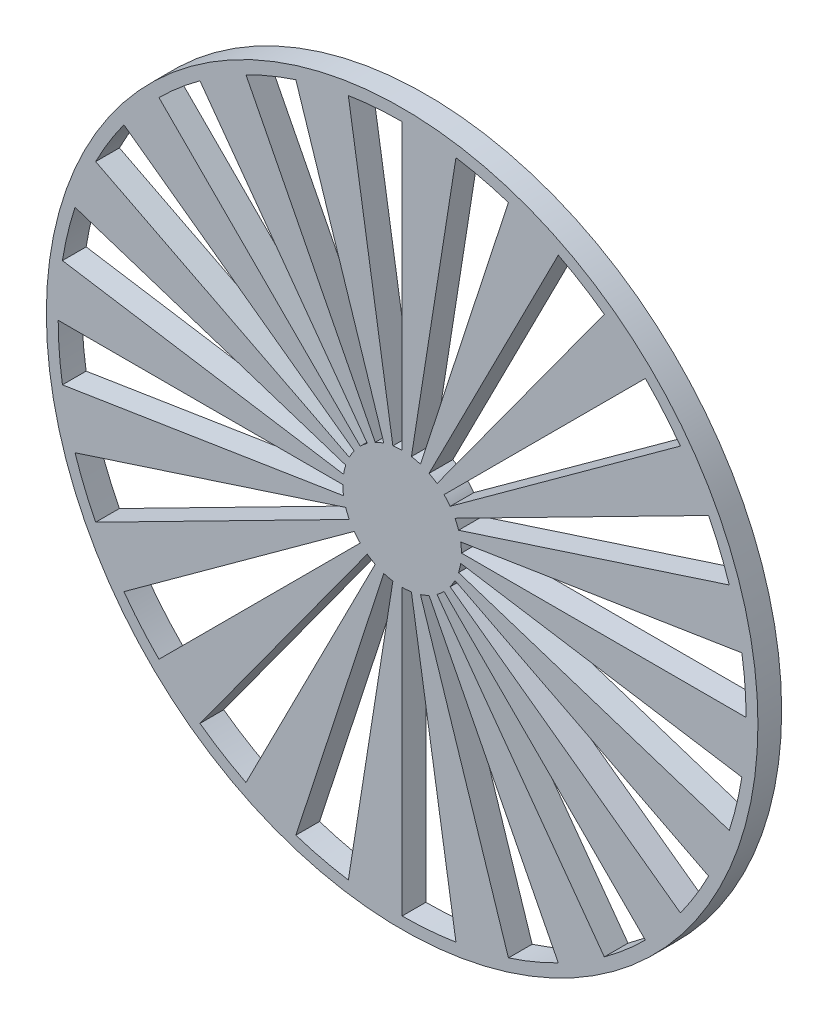
from build123d import *

# Parameters (mm, degrees)
SKETCH1_R           = 38.1
BOSS_EXTRUDE3_DEPTH = 2.54


with BuildPart() as part:
    # Sketch1 → Boss-Extrude3 (new body)
    with BuildSketch(Plane.XY):
        Circle(SKETCH1_R)
        with BuildLine():
            Line((0, -36.83), (0, -6.35))
            ThreePointArc((0, -6.35), (0.498215258, -6.330425069), (0.993358853, -6.271820963))
            Line((0.993358853, -6.271820963), (5.761481347, -36.376561584))
            ThreePointArc((5.761481347, -36.376561584), (2.889648496, -36.716465401), (0, -36.83))
        make_face(mode=Mode.SUBTRACT)
        with BuildLine():
            Line((-0.993358853, -6.271820963), (-5.761481347, -36.376561584))
            ThreePointArc((-5.761481347, -36.376561584), (-8.597792751, -35.812384168), (-11.381095903, -35.027411495))
            Line((-11.381095903, -35.027411495), (-1.962257914, -6.039208878))
            ThreePointArc((-1.962257914, -6.039208878), (-1.48237806, -6.174548995), (-0.993358853, -6.271820963))
        make_face(mode=Mode.SUBTRACT)
        with BuildLine():
            ThreePointArc((16.720470105, -32.815770286), (14.094230814, -34.026483182), (11.381095903, -35.027411495))
            Line((11.381095903, -35.027411495), (1.962257914, -6.039208878))
            ThreePointArc((1.962257914, -6.039208878), (2.430039796, -5.866635031), (2.882839673, -5.657891429))
            Line((2.882839673, -5.657891429), (16.720470105, -32.815770286))
        make_face(mode=Mode.SUBTRACT)
        with BuildLine():
            ThreePointArc((26.042742751, -26.042742751), (23.91917162, -28.005751713), (21.648130842, -29.796095903))
            Line((21.648130842, -29.796095903), (3.732436352, -5.137257914))
            ThreePointArc((3.732436352, -5.137257914), (4.123995107, -4.828577882), (4.490128061, -4.490128061))
            Line((4.490128061, -4.490128061), (26.042742751, -26.042742751))
        make_face(mode=Mode.SUBTRACT)
        with BuildLine():
            ThreePointArc((32.815770286, -16.720470105), (31.402737253, -19.243622138), (29.796095903, -21.648130842))
            Line((29.796095903, -21.648130842), (5.137257914, -3.732436352))
            ThreePointArc((5.137257914, -3.732436352), (5.414265044, -3.317865886), (5.657891429, -2.882839673))
            Line((5.657891429, -2.882839673), (32.815770286, -16.720470105))
        make_face(mode=Mode.SUBTRACT)
        with BuildLine():
            ThreePointArc((36.376561584, -5.761481347), (35.812384168, -8.597792751), (35.027411495, -11.381095903))
            Line((35.027411495, -11.381095903), (6.039208878, -1.962257914))
            ThreePointArc((6.039208878, -1.962257914), (6.174548995, -1.48237806), (6.271820963, -0.993358853))
            Line((6.271820963, -0.993358853), (36.376561584, -5.761481347))
        make_face(mode=Mode.SUBTRACT)
        with BuildLine():
            ThreePointArc((36.376561584, 5.761481347), (36.716465401, 2.889648496), (36.83, 0))
            Line((36.83, 0), (6.35, 0))
            ThreePointArc((6.35, 0), (6.330425069, 0.498215258), (6.271820963, 0.993358853))
            Line((6.271820963, 0.993358853), (36.376561584, 5.761481347))
        make_face(mode=Mode.SUBTRACT)
        with BuildLine():
            ThreePointArc((32.815770286, 16.720470105), (34.026483182, 14.094230814), (35.027411495, 11.381095903))
            Line((35.027411495, 11.381095903), (6.039208878, 1.962257914))
            ThreePointArc((6.039208878, 1.962257914), (5.866635031, 2.430039796), (5.657891429, 2.882839673))
            Line((5.657891429, 2.882839673), (32.815770286, 16.720470105))
        make_face(mode=Mode.SUBTRACT)
        with BuildLine():
            ThreePointArc((26.042742751, 26.042742751), (28.005751713, 23.91917162), (29.796095903, 21.648130842))
            Line((29.796095903, 21.648130842), (5.137257914, 3.732436352))
            ThreePointArc((5.137257914, 3.732436352), (4.828577882, 4.123995107), (4.490128061, 4.490128061))
            Line((4.490128061, 4.490128061), (26.042742751, 26.042742751))
        make_face(mode=Mode.SUBTRACT)
        with BuildLine():
            ThreePointArc((16.720470105, 32.815770286), (19.243622138, 31.402737253), (21.648130842, 29.796095903))
            Line((21.648130842, 29.796095903), (3.732436352, 5.137257914))
            ThreePointArc((3.732436352, 5.137257914), (3.317865886, 5.414265044), (2.882839673, 5.657891429))
            Line((2.882839673, 5.657891429), (16.720470105, 32.815770286))
        make_face(mode=Mode.SUBTRACT)
        with BuildLine():
            ThreePointArc((5.761481347, 36.376561584), (8.597792751, 35.812384168), (11.381095903, 35.027411495))
            Line((11.381095903, 35.027411495), (1.962257914, 6.039208878))
            ThreePointArc((1.962257914, 6.039208878), (1.48237806, 6.174548995), (0.993358853, 6.271820963))
            Line((0.993358853, 6.271820963), (5.761481347, 36.376561584))
        make_face(mode=Mode.SUBTRACT)
        with BuildLine():
            ThreePointArc((-5.761481347, 36.376561584), (-2.889648496, 36.716465401), (0, 36.83))
            Line((0, 36.83), (0, 6.35))
            ThreePointArc((0, 6.35), (-0.498215258, 6.330425069), (-0.993358853, 6.271820963))
            Line((-0.993358853, 6.271820963), (-5.761481347, 36.376561584))
        make_face(mode=Mode.SUBTRACT)
        with BuildLine():
            ThreePointArc((-16.720470105, 32.815770286), (-14.094230814, 34.026483182), (-11.381095903, 35.027411495))
            Line((-11.381095903, 35.027411495), (-1.962257914, 6.039208878))
            ThreePointArc((-1.962257914, 6.039208878), (-2.430039796, 5.866635031), (-2.882839673, 5.657891429))
            Line((-2.882839673, 5.657891429), (-16.720470105, 32.815770286))
        make_face(mode=Mode.SUBTRACT)
        with BuildLine():
            ThreePointArc((-26.042742751, 26.042742751), (-23.91917162, 28.005751713), (-21.648130842, 29.796095903))
            Line((-21.648130842, 29.796095903), (-3.732436352, 5.137257914))
            ThreePointArc((-3.732436352, 5.137257914), (-4.123995107, 4.828577882), (-4.490128061, 4.490128061))
            Line((-4.490128061, 4.490128061), (-26.042742751, 26.042742751))
        make_face(mode=Mode.SUBTRACT)
        with BuildLine():
            ThreePointArc((-32.815770286, 16.720470105), (-31.402737253, 19.243622138), (-29.796095903, 21.648130842))
            Line((-29.796095903, 21.648130842), (-5.137257914, 3.732436352))
            ThreePointArc((-5.137257914, 3.732436352), (-5.414265044, 3.317865886), (-5.657891429, 2.882839673))
            Line((-5.657891429, 2.882839673), (-32.815770286, 16.720470105))
        make_face(mode=Mode.SUBTRACT)
        with BuildLine():
            ThreePointArc((-36.376561584, 5.761481347), (-35.812384168, 8.597792751), (-35.027411495, 11.381095903))
            Line((-35.027411495, 11.381095903), (-6.039208878, 1.962257914))
            ThreePointArc((-6.039208878, 1.962257914), (-6.174548995, 1.48237806), (-6.271820963, 0.993358853))
            Line((-6.271820963, 0.993358853), (-36.376561584, 5.761481347))
        make_face(mode=Mode.SUBTRACT)
        with BuildLine():
            ThreePointArc((-36.376561584, -5.761481347), (-36.716465401, -2.889648496), (-36.83, 0))
            Line((-36.83, 0), (-6.35, 0))
            ThreePointArc((-6.35, 0), (-6.330425069, -0.498215258), (-6.271820963, -0.993358853))
            Line((-6.271820963, -0.993358853), (-36.376561584, -5.761481347))
        make_face(mode=Mode.SUBTRACT)
        with BuildLine():
            ThreePointArc((-32.815770286, -16.720470105), (-34.026483182, -14.094230814), (-35.027411495, -11.381095903))
            Line((-35.027411495, -11.381095903), (-6.039208878, -1.962257914))
            ThreePointArc((-6.039208878, -1.962257914), (-5.866635031, -2.430039796), (-5.657891429, -2.882839673))
            Line((-5.657891429, -2.882839673), (-32.815770286, -16.720470105))
        make_face(mode=Mode.SUBTRACT)
        with BuildLine():
            ThreePointArc((-26.042742751, -26.042742751), (-28.005751713, -23.91917162), (-29.796095903, -21.648130842))
            Line((-29.796095903, -21.648130842), (-5.137257914, -3.732436352))
            ThreePointArc((-5.137257914, -3.732436352), (-4.828577882, -4.123995107), (-4.490128061, -4.490128061))
            Line((-4.490128061, -4.490128061), (-26.042742751, -26.042742751))
        make_face(mode=Mode.SUBTRACT)
        with BuildLine():
            ThreePointArc((-16.720470105, -32.815770286), (-19.243622138, -31.402737253), (-21.648130842, -29.796095903))
            Line((-21.648130842, -29.796095903), (-3.732436352, -5.137257914))
            ThreePointArc((-3.732436352, -5.137257914), (-3.317865886, -5.414265044), (-2.882839673, -5.657891429))
            Line((-2.882839673, -5.657891429), (-16.720470105, -32.815770286))
        make_face(mode=Mode.SUBTRACT)
    extrude(amount=BOSS_EXTRUDE3_DEPTH)


solid = part.part
